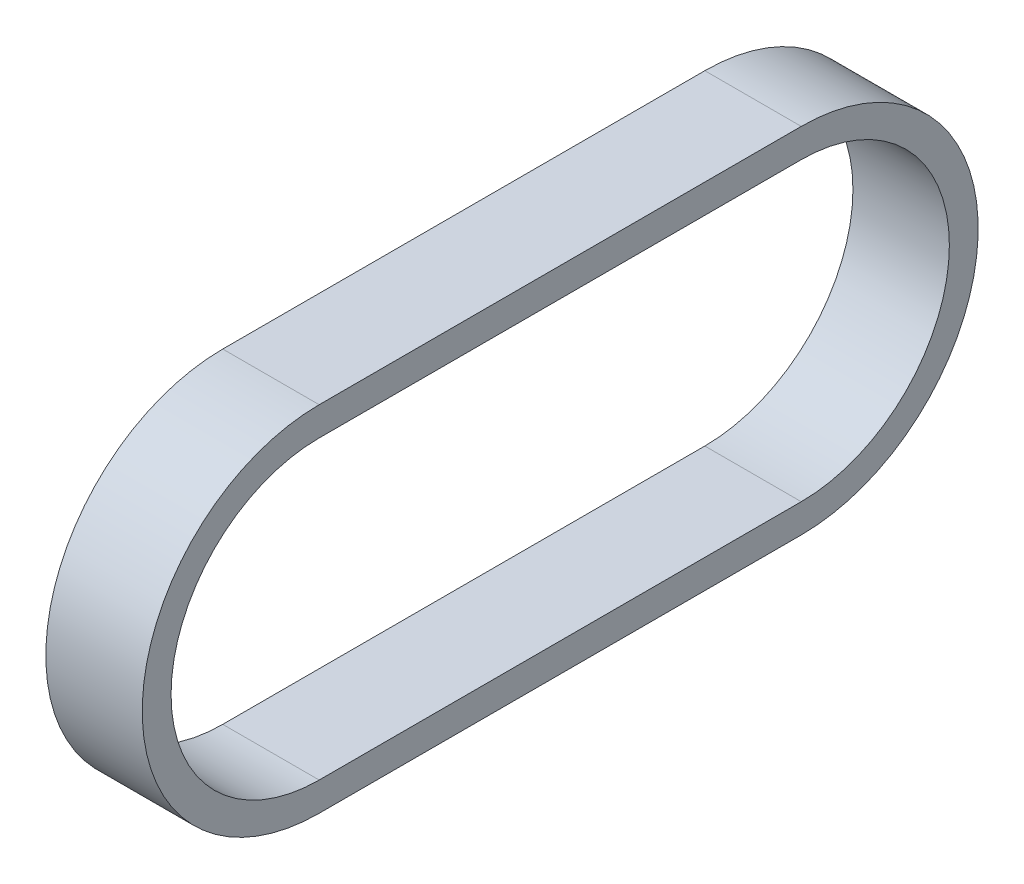
from build123d import *

# Parameters (mm, degrees)
EXTRUDE_THIN1_DEPTH = 8.5


with BuildPart() as part:
    # Sketch1 → Extrude-Thin1 (new body)
    with BuildSketch(Plane(origin=(0, 0, 0), x_dir=(0, 0, -1), z_dir=(1, 0, 0))):
        with BuildLine():
            Line((21.2471, -15.5956), (-21.2471, -15.5956))
            ThreePointArc((-21.2471, -15.5956), (-36.8427, 0), (-21.2471, 15.5956))
            Line((-21.2471, 15.5956), (21.2471, 15.5956))
            ThreePointArc((21.2471, 15.5956), (36.8427, 0), (21.2471, -15.5956))
        make_face()
        with BuildLine():
            Line((21.2471, -13.0556), (-21.2471, -13.0556))
            ThreePointArc((-21.2471, -13.0556), (-34.3027, 0), (-21.2471, 13.0556))
            Line((-21.2471, 13.0556), (21.2471, 13.0556))
            ThreePointArc((21.2471, 13.0556), (34.3027, 0), (21.2471, -13.0556))
        make_face(mode=Mode.SUBTRACT)
    extrude(amount=EXTRUDE_THIN1_DEPTH)


solid = part.part
